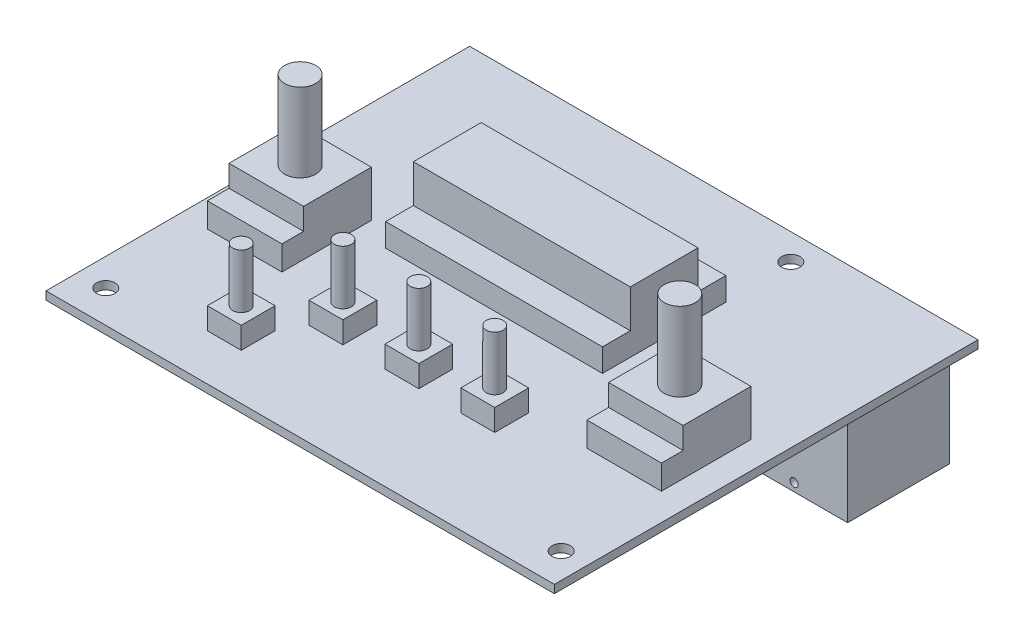
from build123d import *

# Parameters (mm, degrees)
SKETCH1_W                             = 95.25
SKETCH1_H                             = 79.375
BOSS_EXTRUDE1_DEPTH                   = 1.524
F_29_0_136_DIAMETER_HOLE1_D           = 3.4544
SKETCH4_W                             = 13.97
SKETCH4_H                             = 16.764
BOSS_EXTRUDE2_DEPTH                   = 4.572
SKETCH5_W                             = 13.97
SKETCH5_H                             = 12.7
BOSS_EXTRUDE3_DEPTH                   = 4.064
SKETCH8_W                             = 6.35
SKETCH8_H                             = 6.35
BOSS_EXTRUDE5_DEPTH                   = 4.064
SKETCH9_R                             = 1.5875
BOSS_EXTRUDE6_DEPTH                   = 10.16
SKETCH10_R                            = 2.921
BOSS_EXTRUDE7_DEPTH                   = 14.732
SKETCH11_W                            = 20.0152
SKETCH11_H                            = 21.336
BOSS_EXTRUDE8_DEPTH                   = 19.05
SKETCH12_R                            = 6.985
CUT_EXTRUDE1_DEPTH                    = 3.175
SKETCH14_W                            = 0.75565
SKETCH14_H                            = 79.375
F_53_0_0595_DIAMETER_HOLE1_AT_2_COUNT = 2
F_53_0_0595_DIAMETER_HOLE1_AT_2_PITCH = 17.4879
F_53_0_0595_DIAMETER_HOLE1_AT_3_COUNT = 2
F_53_0_0595_DIAMETER_HOLE1_AT_3_PITCH = 16.783370835
SKETCH15_W                            = 5.969
SKETCH15_H                            = 5.334
BOSS_EXTRUDE9_DEPTH                   = 13.97
SKETCH16_R                            = 2.54
SKETCH16_R_2                          = 1.778
BOSS_EXTRUDE10_DEPTH                  = 2.032
BOSS_EXTRUDE10_DRAFT                  = 9
SKETCH17_R                            = 1.778
CUT_EXTRUDE2_DEPTH                    = 12.7
SKETCH18_W                            = 40.64
SKETCH18_H                            = 23.114
BOSS_EXTRUDE11_DEPTH                  = 4.318
SKETCH19_W                            = 40.64
SKETCH19_H                            = 12.7
BOSS_EXTRUDE12_DEPTH                  = 7.112
SKETCH20_W                            = 33.02
SKETCH20_H                            = 2.410000006
BOSS_EXTRUDE13_DEPTH                  = 2.54
SKETCH21_W                            = 8.89
SKETCH21_H                            = 4.572
BOSS_EXTRUDE14_DEPTH                  = 4.826
SKETCH22_W                            = 8.89
SKETCH22_H                            = 2.032
BOSS_EXTRUDE15_DEPTH                  = 1.524


with BuildPart() as part:
    # Sketch1 → Boss-Extrude1 (new body)
    with BuildSketch(Plane(origin=(0, 0, 0), x_dir=(1, 0, 0), z_dir=(0, 1, 0))):
        Rectangle(SKETCH1_W, SKETCH1_H)
    extrude(amount=BOSS_EXTRUDE1_DEPTH)

    # #29 (0.136) Diameter Hole1 (through all)
    with Locations(Plane(origin=(0, 1.524, 0), x_dir=(1, 0, 0), z_dir=(0, 1, 0))):
        with Locations((42.8498, -33.6423), (17.4498, 34.7853), (-25.8318, 22.2123), (-42.4688, -33.6423)):
            Hole(F_29_0_136_DIAMETER_HOLE1_D / 2)

    # Sketch4 → Boss-Extrude2 (add)
    with BuildSketch(Plane(origin=(0, 1.524, 0), x_dir=(1, 0, 0), z_dir=(0, 1, 0))):
        with Locations((35.56, -6.1595)):
            Rectangle(SKETCH4_W, SKETCH4_H)
        with Locations((-35.56, -6.1595)):
            Rectangle(SKETCH4_W, SKETCH4_H)
    extrude(amount=BOSS_EXTRUDE2_DEPTH)

    # Sketch5 → Boss-Extrude3 (add)
    with BuildSketch(Plane(origin=(0, 6.096, 0), x_dir=(1, 0, 0), z_dir=(0, 1, 0))):
        with Locations((-35.56, -4.1275)):
            Rectangle(SKETCH5_W, SKETCH5_H)
        with Locations((35.56, -4.1275)):
            Rectangle(SKETCH5_W, SKETCH5_H)
    extrude(amount=BOSS_EXTRUDE3_DEPTH)

    # Sketch8 → Boss-Extrude5 (add)
    with BuildSketch(Plane(origin=(0, 1.524, 0), x_dir=(1, 0, 0), z_dir=(0, 1, 0))):
        with Locations((-22.86, -27.8765)):
            Rectangle(SKETCH8_W, SKETCH8_H)
        with Locations((14.224, -17.4625)):
            Rectangle(SKETCH8_W, SKETCH8_H)
        with Locations((0, -17.4625)):
            Rectangle(SKETCH8_W, SKETCH8_H)
        with Locations((-14.224, -17.4625)):
            Rectangle(SKETCH8_W, SKETCH8_H)
    extrude(amount=BOSS_EXTRUDE5_DEPTH)

    # Sketch9 → Boss-Extrude6 (add)
    with BuildSketch(Plane(origin=(0, 5.588, 0), x_dir=(1, 0, 0), z_dir=(0, 1, 0))):
        with Locations(Location((-13.942192497, -17.744307503, 0), (0, 0, 90))):
            Circle(SKETCH9_R)
        with Locations(Location((0, -17.4625, 0), (0, 0, 90))):
            Circle(SKETCH9_R)
        with Locations(Location((14.224, -17.4625, 0), (0, 0, 90))):
            Circle(SKETCH9_R)
        with Locations(Location((-22.86, -27.8765, 0), (0, 0, 90))):
            Circle(SKETCH9_R)
    extrude(amount=BOSS_EXTRUDE6_DEPTH)

    # Sketch10 → Boss-Extrude7 (add)
    with BuildSketch(Plane(origin=(0, 10.16, 0), x_dir=(1, 0, 0), z_dir=(0, 1, 0))):
        with Locations(Location((-35.56, -4.1275, 0), (0, 0, 270))):
            Circle(SKETCH10_R)
        with Locations(Location((35.56, -4.1275, 0), (0, 0, 270))):
            Circle(SKETCH10_R)
    extrude(amount=BOSS_EXTRUDE7_DEPTH)

    # Sketch15 → Boss-Extrude9 (add)
    with BuildSketch(Plane(origin=(0, 0, -39.6875), x_dir=(-1, 0, 0), z_dir=(0, 0, -1))):
        with Locations((37.9095, -2.667)):
            Rectangle(SKETCH15_W, SKETCH15_H)
    extrude(amount=-BOSS_EXTRUDE9_DEPTH)


with BuildPart() as body_2:
    # Sketch11 → Boss-Extrude8 (new body)
    with BuildSketch(Plane(origin=(0, 0, -39.6875), x_dir=(-1, 0, 0), z_dir=(0, 0, -1))):
        with Locations((-32.2326, -10.668)):
            Rectangle(SKETCH11_W, SKETCH11_H)
    extrude(amount=-BOSS_EXTRUDE8_DEPTH)

    # Sketch12 → Cut-Extrude1 (cut)
    with BuildSketch(Plane(origin=(0, 0, -39.6875), x_dir=(-1, 0, 0), z_dir=(0, 0, -1))):
        with Locations((-32.2326, -10.541)):
            Circle(SKETCH12_R)
    extrude(amount=-CUT_EXTRUDE1_DEPTH, mode=Mode.SUBTRACT)

    # Sketch14 → #53 (0.0595) Diameter Hole1 (revolve, cut)
    with BuildSketch(Plane(origin=(40.97655, -5.492678114, -39.6875), x_dir=(0, 1, 0), z_dir=(1, 0, 0))):
        with Locations((0.377825, 39.6875)):
            Rectangle(SKETCH14_W, SKETCH14_H)
    f_53_0_0595_diameter_hole1 = revolve(axis=Axis((40.97655, -5.492678114, -46.0375), (0, 0, 1)), mode=Mode.SUBTRACT)

    # #53 (0.0595) Diameter Hole1 at 2: #53 (0.0595) Diameter Hole1 ×2
    with Locations(*[(-i * F_53_0_0595_DIAMETER_HOLE1_AT_2_PITCH, 0, 0) for i in range(1, F_53_0_0595_DIAMETER_HOLE1_AT_2_COUNT)]):
        add(f_53_0_0595_diameter_hole1, mode=Mode.SUBTRACT)

    # #53 (0.0595) Diameter Hole1 at 3: #53 (0.0595) Diameter Hole1 ×2
    with Locations(*[Vector(-0.5209889053752342, -0.8535634484184028, 0) * (i * F_53_0_0595_DIAMETER_HOLE1_AT_3_PITCH) for i in range(1, F_53_0_0595_DIAMETER_HOLE1_AT_3_COUNT)]):
        add(f_53_0_0595_diameter_hole1, mode=Mode.SUBTRACT)


with BuildPart() as boss_extrude10_tool:
    # Sketch16 → Boss-Extrude10 (with draft: the straight prism first)
    with BuildSketch(Plane(origin=(0, 0, -39.6875), x_dir=(-1, 0, 0), z_dir=(0, 0, -1))):
        with Locations((37.9095, -2.667)):
            Circle(SKETCH16_R)
        with Locations((37.9095, -2.667)):
            Circle(SKETCH16_R_2, mode=Mode.SUBTRACT)
    extrude(amount=BOSS_EXTRUDE10_DEPTH)
    # Boss-Extrude10: the draft: its side faces are tilted about the plane it starts from
    boss_extrude10_sides = [boss_extrude10_tool.faces().sort_by_distance(p)[0] for p in [
        (-35.3695, -2.667, -40.7035),
        (-36.1315, -2.667, -40.7035),
    ]]
    draft(boss_extrude10_sides, Plane(origin=(0, 0, -39.6875), x_dir=(-1, 0, 0), z_dir=(0, 0, -1)), BOSS_EXTRUDE10_DRAFT)


with BuildPart() as part_1:
    add(part.part)

    # Boss-Extrude10: add boss_extrude10_tool
    add(boss_extrude10_tool.part)

    # Sketch17 → Cut-Extrude2 (cut)
    with BuildSketch(Plane(origin=(0, 0, -39.6875), x_dir=(-1, 0, 0), z_dir=(0, 0, -1))):
        with Locations((37.9095, -2.667)):
            Circle(SKETCH17_R)
    extrude(amount=-CUT_EXTRUDE2_DEPTH, mode=Mode.SUBTRACT)

    # Sketch18 → Boss-Extrude11 (add)
    with BuildSketch(Plane(origin=(0, 1.524, 0), x_dir=(1, 0, 0), z_dir=(0, 1, 0))):
        with Locations((-2.413, 10.6045)):
            Rectangle(SKETCH18_W, SKETCH18_H)
    extrude(amount=BOSS_EXTRUDE11_DEPTH)

    # Sketch19 → Boss-Extrude12 (add)
    with BuildSketch(Plane(origin=(0, 5.842, 0), x_dir=(1, 0, 0), z_dir=(0, 1, 0))):
        with Locations((-2.413, 10.6045)):
            Rectangle(SKETCH19_W, SKETCH19_H)
    extrude(amount=BOSS_EXTRUDE12_DEPTH)

    # Sketch20 → Boss-Extrude13 (add)
    with BuildSketch(Plane.XZ):
        with Locations((1.143, 34.672499997)):
            Rectangle(SKETCH20_W, SKETCH20_H)
    extrude(amount=BOSS_EXTRUDE13_DEPTH)

    # Sketch21 → Boss-Extrude14 (add)
    with BuildSketch(Plane.XZ):
        with Locations((-1.016, -37.4015)):
            Rectangle(SKETCH21_W, SKETCH21_H)
    extrude(amount=BOSS_EXTRUDE14_DEPTH)

    # Sketch22 → Boss-Extrude15 (add)
    with BuildSketch(Plane(origin=(0, 0, -39.6875), x_dir=(-1, 0, 0), z_dir=(0, 0, -1))):
        with Locations((1.016, -2.413)):
            Rectangle(SKETCH22_W, SKETCH22_H)
    extrude(amount=BOSS_EXTRUDE15_DEPTH)


solid = Compound([body_2.part, part_1.part])
